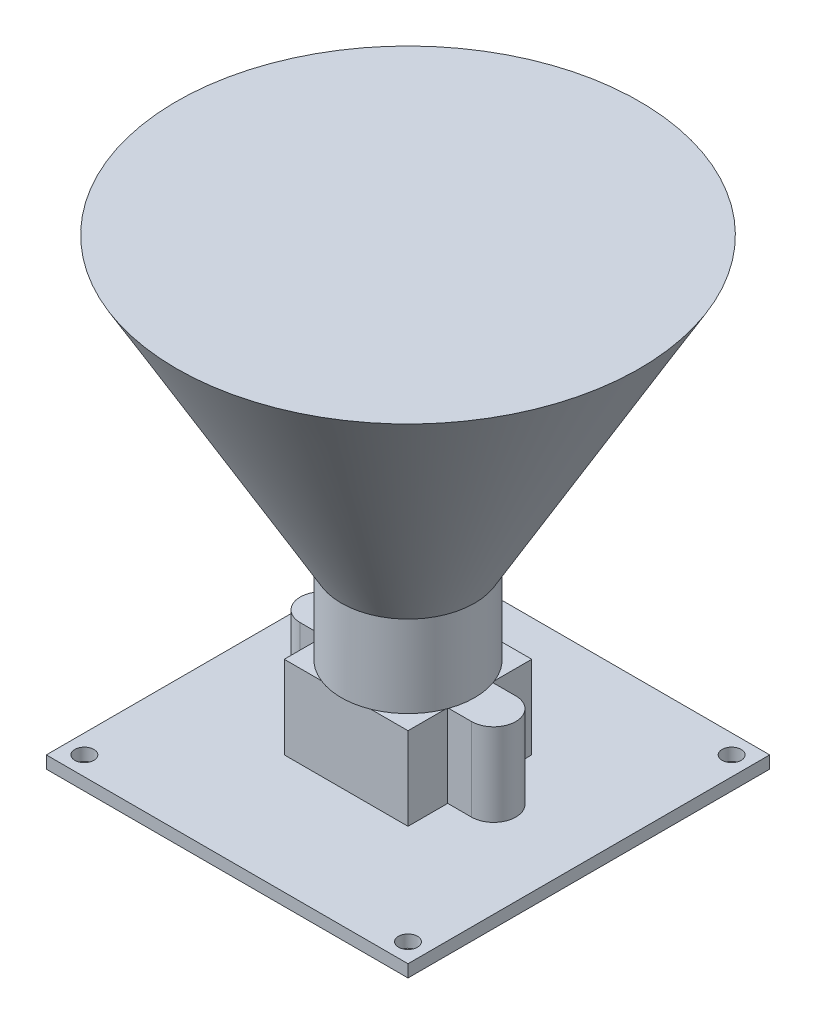
from build123d import *

# Parameters (mm, degrees)
SKETCH1_W           = 38
SKETCH1_H           = 38
SKETCH1_R           = 1
BOSS_EXTRUDE1_DEPTH = 1.3
BOSS_EXTRUDE2_DEPTH = 8.7
SKETCH3_R           = 7
BOSS_EXTRUDE3_DEPTH = 8.6
SKETCH4_R           = 7
BOSS_EXTRUDE4_DEPTH = 30
BOSS_EXTRUDE4_DRAFT = -30


with BuildPart() as part:
    # Sketch1 → Boss-Extrude1 (new body)
    with BuildSketch(Plane(origin=(0, 0, 0), x_dir=(1, 0, 0), z_dir=(0, 1, 0))):
        with Locations((4.613461538, -5.005769231)):
            Rectangle(SKETCH1_W, SKETCH1_H)
        with Locations((-12.386538462, 11.994230769)):
            Circle(SKETCH1_R, mode=Mode.SUBTRACT)
        with Locations((21.613461538, 11.994230769)):
            Circle(SKETCH1_R, mode=Mode.SUBTRACT)
        with Locations((21.613461538, -22.005769231)):
            Circle(SKETCH1_R, mode=Mode.SUBTRACT)
        with Locations((-12.386538462, -22.005769231)):
            Circle(SKETCH1_R, mode=Mode.SUBTRACT)
    extrude(amount=BOSS_EXTRUDE1_DEPTH)

    # Sketch2 → Boss-Extrude2 (add)
    with BuildSketch(Plane(origin=(0, 1.3, 0), x_dir=(1, 0, 0), z_dir=(0, 1, 0))):
        with BuildLine():
            Line((-1.886538462, -11.505769231), (11.113461538, -11.505769231))
            Line((11.113461538, -11.505769231), (11.113461538, -7.333742244))
            Line((11.113461538, -7.333742244), (13.613461538, -7.333742244))
            ThreePointArc((13.613461538, -7.333742244), (15.941434552, -5.005769231), (13.613461538, -2.677796217))
            Line((13.613461538, -2.677796217), (11.113461538, -2.677796217))
            Line((11.113461538, -2.677796217), (11.113461538, 1.494230769))
            Line((11.113461538, 1.494230769), (-1.886538462, 1.494230769))
            Line((-1.886538462, 1.494230769), (-1.886538462, -2.677796217))
            Line((-1.886538462, -2.677796217), (-4.386538462, -2.677796217))
            ThreePointArc((-4.386538462, -2.677796217), (-6.714511475, -5.005769231), (-4.386538462, -7.333742244))
            Line((-4.386538462, -7.333742244), (-1.886538462, -7.333742244))
            Line((-1.886538462, -7.333742244), (-1.886538462, -11.505769231))
        make_face()
    extrude(amount=BOSS_EXTRUDE2_DEPTH)

    # Sketch3 → Boss-Extrude3 (add)
    with BuildSketch(Plane(origin=(0, 10, 0), x_dir=(1, 0, 0), z_dir=(0, 1, 0))):
        with Locations((4.613461538, -5.005769231)):
            Circle(SKETCH3_R)
    extrude(amount=BOSS_EXTRUDE3_DEPTH)


with BuildPart() as boss_extrude4_tool:
    # Sketch4 → Boss-Extrude4 (with draft: the straight prism first)
    with BuildSketch(Plane(origin=(0, 18.6, 0), x_dir=(1, 0, 0), z_dir=(0, 1, 0))):
        with Locations((4.613461538, -5.005769231)):
            Circle(SKETCH4_R)
    extrude(amount=BOSS_EXTRUDE4_DEPTH)
    # Boss-Extrude4: the draft: its side faces are tilted about the plane it starts from
    boss_extrude4_sides = [boss_extrude4_tool.faces().sort_by_distance(p)[0] for p in [
        (-2.386538462, 33.6, 5.005769231),
    ]]
    draft(boss_extrude4_sides, Plane(origin=(0, 18.6, 0), x_dir=(1, 0, 0), z_dir=(0, 1, 0)), BOSS_EXTRUDE4_DRAFT)


with BuildPart() as part_1:
    add(part.part)

    # Boss-Extrude4: add boss_extrude4_tool
    add(boss_extrude4_tool.part)


solid = part_1.part
